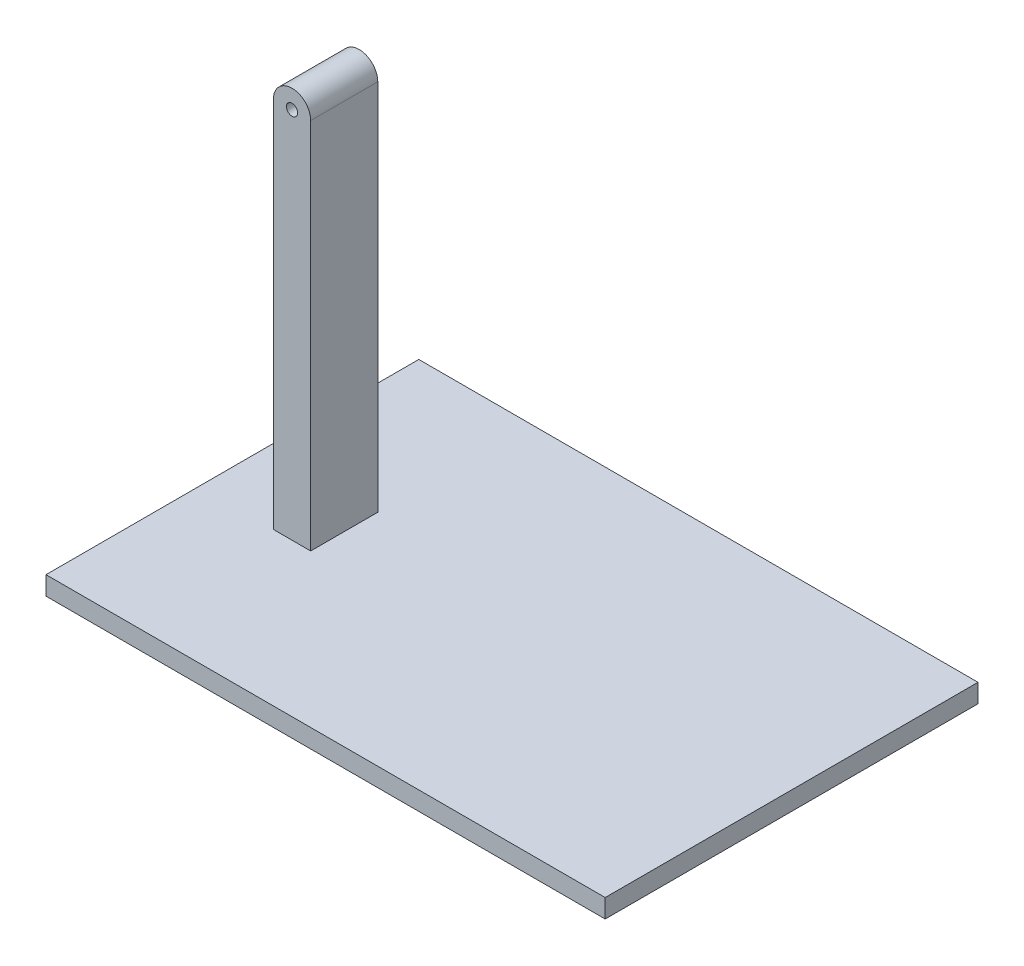
from build123d import *

# Parameters (mm, degrees)
BOSS_EXTRUDE1_DEPTH = 1.27
SKETCH2_W           = 2.54
SKETCH2_H           = 4.572
BOSS_EXTRUDE2_DEPTH = 25.4
SKETCH3_R           = 1.27
BOSS_EXTRUDE3_DEPTH = 4.572
SKETCH4_R           = 0.381
CUT_EXTRUDE1_DEPTH  = 4.572


with BuildPart() as part:
    # Sketch1 → Boss-Extrude1 (new body)
    with BuildSketch(Plane(origin=(0, 0, 0), x_dir=(1, 0, 0), z_dir=(0, 1, 0))):
        Polygon((-12.7, 12.7), (12.7, 12.7), (25.4, 12.7), (25.4, -12.7), (12.7, -12.7), (-12.7, -12.7), align=None)
    extrude(amount=BOSS_EXTRUDE1_DEPTH)

    # Sketch2 → Boss-Extrude2 (add)
    with BuildSketch(Plane(origin=(0, 1.27, 0), x_dir=(1, 0, 0), z_dir=(0, 1, 0))):
        with Locations((-6.35, 0)):
            Rectangle(SKETCH2_W, SKETCH2_H)
    extrude(amount=BOSS_EXTRUDE2_DEPTH)

    # Sketch3 → Boss-Extrude3 (add)
    with BuildSketch(Plane.XY.offset(2.286)):
        with Locations((-6.35, 26.67)):
            Circle(SKETCH3_R)
    extrude(amount=-BOSS_EXTRUDE3_DEPTH)

    # Sketch4 → Cut-Extrude1 (cut)
    with BuildSketch(Plane.XY.offset(2.286)):
        with Locations((-6.35, 26.67)):
            Circle(SKETCH4_R)
    extrude(amount=-CUT_EXTRUDE1_DEPTH, mode=Mode.SUBTRACT)


solid = part.part
